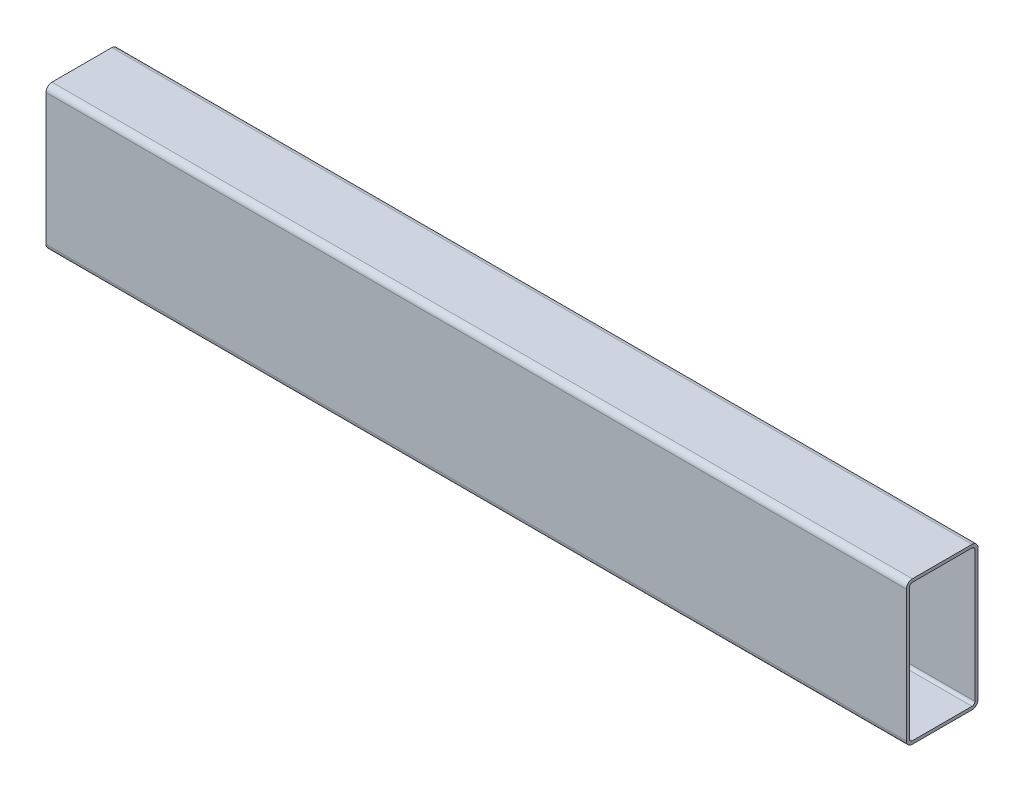
from build123d import *

# Parameters (mm, degrees)
EXTRUDE_THIN2_DEPTH = 457.2


with BuildPart() as part:
    # Sketch1 → Extrude-Thin2 (new body)
    with BuildSketch(Plane(origin=(0, 0, 0), x_dir=(0, 0, -1), z_dir=(1, 0, 0))):
        with BuildLine():
            Line((22.252869444, 65.934166667), (-9.497130556, 65.934166667))
            ThreePointArc((-9.497130556, 65.934166667), (-11.742194586, 65.004230697), (-12.672130556, 62.759166667))
            Line((-12.672130556, 62.759166667), (-12.672130556, -7.090833333))
            ThreePointArc((-12.672130556, -7.090833333), (-11.742194586, -9.335897364), (-9.497130556, -10.265833333))
            Line((-9.497130556, -10.265833333), (22.252869444, -10.265833333))
            ThreePointArc((22.252869444, -10.265833333), (24.497933475, -9.335897364), (25.427869444, -7.090833333))
            Line((25.427869444, -7.090833333), (25.427869444, 62.759166667))
            ThreePointArc((25.427869444, 62.759166667), (24.497933475, 65.004230697), (22.252869444, 65.934166667))
        make_face()
        with BuildLine():
            Line((22.252869444, 64.283166667), (-9.497130556, 64.283166667))
            ThreePointArc((-9.497130556, 64.283166667), (-10.57476129, 63.836797401), (-11.021130556, 62.759166667))
            Line((-11.021130556, 62.759166667), (-11.021130556, -7.090833333))
            ThreePointArc((-11.021130556, -7.090833333), (-10.57476129, -8.168464068), (-9.497130556, -8.614833333))
            Line((-9.497130556, -8.614833333), (22.252869444, -8.614833333))
            ThreePointArc((22.252869444, -8.614833333), (23.330500179, -8.168464068), (23.776869444, -7.090833333))
            Line((23.776869444, -7.090833333), (23.776869444, 62.759166667))
            ThreePointArc((23.776869444, 62.759166667), (23.330500179, 63.836797401), (22.252869444, 64.283166667))
        make_face(mode=Mode.SUBTRACT)
    extrude(amount=EXTRUDE_THIN2_DEPTH)


solid = part.part
